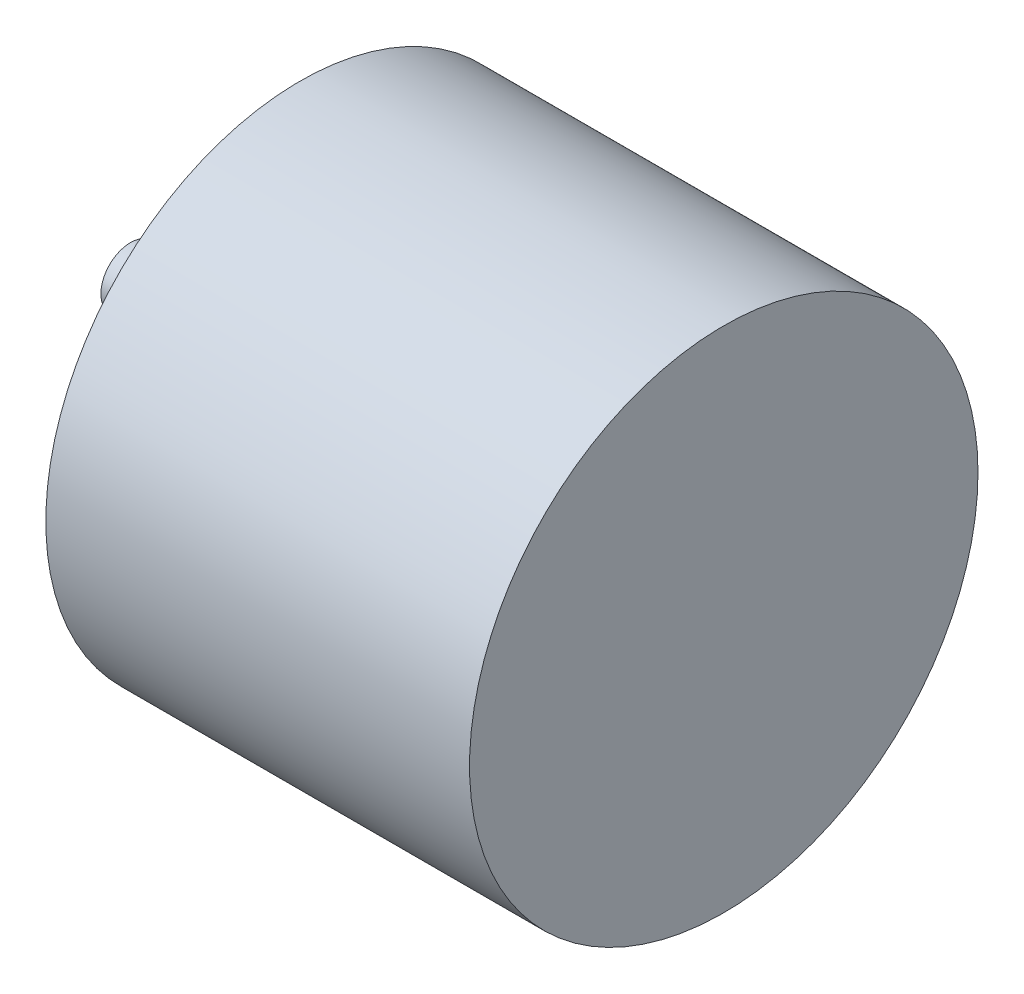
from build123d import *

# Parameters (mm, degrees)
SKETCH_1_R      = 30
EXTRUDE_1_DEPTH = 50
SKETCH_2_R      = 3.5
EXTRUDE_2_DEPTH = 20


with BuildPart() as part:
    # ｽｹｯﾁ1 → ﾎﾞｽ - 押し出し1 (new body)
    with BuildSketch(Plane(origin=(0, 0, 0), x_dir=(0, 0, -1), z_dir=(1, 0, 0))):
        Circle(SKETCH_1_R)
    extrude(amount=EXTRUDE_1_DEPTH)

    # ｽｹｯﾁ2 → ﾎﾞｽ - 押し出し2 (add)
    with BuildSketch(Plane.ZY):
        with Locations(Location((0, 0, 0), (0, 0, 180))):
            Circle(SKETCH_2_R)
    extrude(amount=EXTRUDE_2_DEPTH)


solid = part.part
